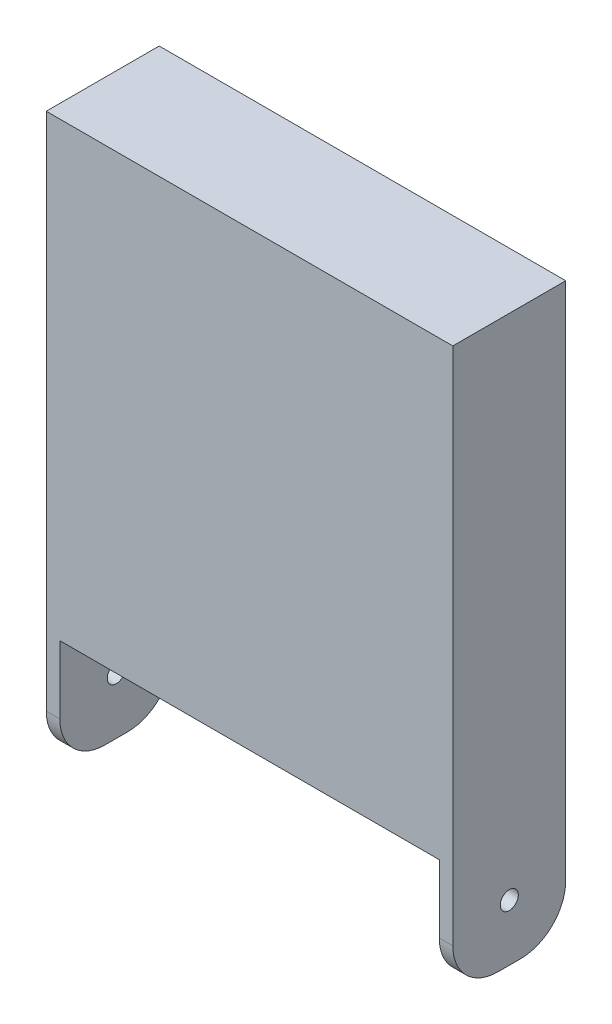
from build123d import *

# Parameters (mm, degrees)
SKETCH1_W           = 180
SKETCH1_H           = 50
EXTRUDE1_DEPTH      = 200
SKETCH2_W           = 6
SKETCH2_H           = 50
EXTRUDE2_DEPTH      = 50
EXTRUDE3_DEPTH      = 477
EXTRUDE3_DEPTH_BACK = 40
SKETCH3_R           = 4
FILLET1_R           = 20


with BuildPart() as part:
    # Sketch1 → Extrude1 (new body)
    with BuildSketch(Plane(origin=(0, 0, 0), x_dir=(1, 0, 0), z_dir=(0, 1, 0))):
        Rectangle(SKETCH1_W, SKETCH1_H)
    extrude(amount=EXTRUDE1_DEPTH)

    # Sketch2 → Extrude2 (add)
    with BuildSketch(Plane.XZ):
        with Locations((-87, 0)):
            Rectangle(SKETCH2_W, SKETCH2_H)
        with Locations((87, 0)):
            Rectangle(SKETCH2_W, SKETCH2_H)
    extrude(amount=EXTRUDE2_DEPTH)

    # Sketch3 → Extrude3 (cut, two sides: drawn at the far end of the back side and taken through both)
    with BuildSketch(Plane.ZY.offset(-84).offset(-EXTRUDE3_DEPTH_BACK)):
        with Locations(Location((0, -25, 0), (0, 0, 180))):
            Circle(SKETCH3_R)
    extrude(amount=EXTRUDE3_DEPTH + EXTRUDE3_DEPTH_BACK, mode=Mode.SUBTRACT)

    # Fillet1
    fillet1_edges = [part.edges().sort_by_distance(p)[0] for p in [
        (-87, -50, -25),
        (-87, -50, 25),
        (87, -50, 25),
        (87, -50, -25),
    ]]
    fillet(fillet1_edges, radius=FILLET1_R)


solid = part.part
